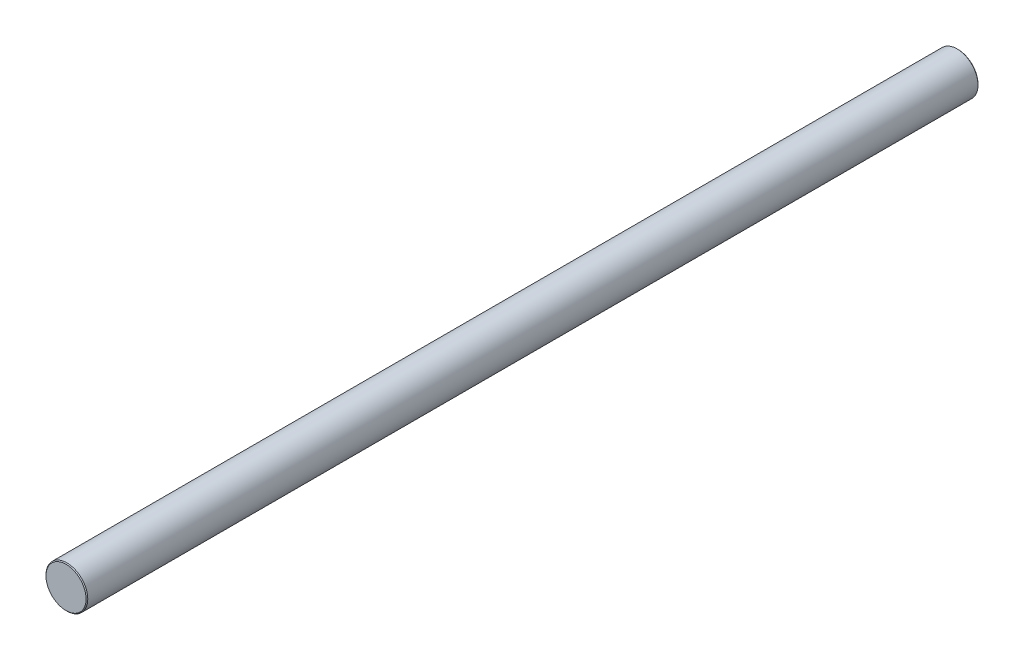
from build123d import *

# Parameters (mm, degrees)
BOSS_EXTRUDE1_DEPTH      = 101.6
BOSS_EXTRUDE1_DEPTH_BACK = 101.6
SKETCH3_R                = 4.7625
CHAMFER1_SIZE            = 0.1905


with BuildPart() as part:
    # Sketch3 → Boss-Extrude1 (new, two sides: drawn at the far end of the back side and taken through both)
    with BuildSketch(Plane.XY.offset(-BOSS_EXTRUDE1_DEPTH_BACK)):
        Circle(SKETCH3_R)
    extrude(amount=BOSS_EXTRUDE1_DEPTH + BOSS_EXTRUDE1_DEPTH_BACK)

    # Chamfer1
    chamfer1_edges = [part.edges().sort_by_distance(p)[0] for p in [
        (-4.7625, 0, -101.6),
        (-4.7625, 0, 101.6),
    ]]
    chamfer(chamfer1_edges, length=CHAMFER1_SIZE)


solid = part.part
